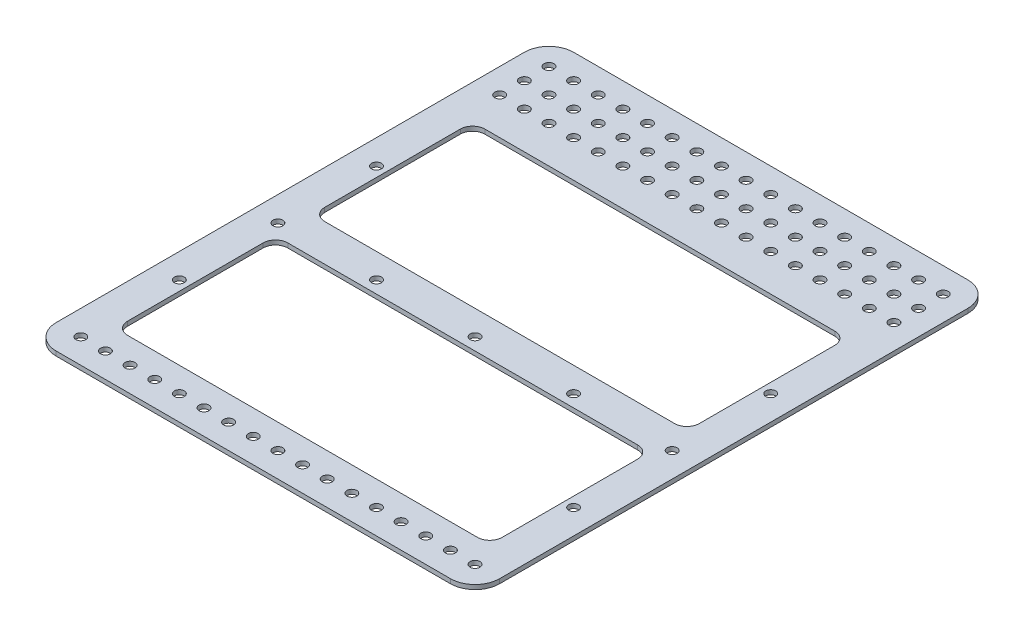
from build123d import *

# Parameters (mm, degrees)
SKETCH3_W           = 228.6
SKETCH3_H           = 266.7
SKETCH3_R           = 2.54
SKETCH3_W_2         = 193.04
SKETCH3_H_2         = 82.55
BOSS_EXTRUDE3_DEPTH = 2.286
FILLET5_R           = 12.7
FILLET6_R           = 6.35


with BuildPart() as part:
    # Sketch3 → Boss-Extrude3 (new body)
    with BuildSketch(Plane(origin=(0, 0, 0), x_dir=(1, 0, 0), z_dir=(0, 1, 0))):
        with Locations((114.3, 133.35)):
            Rectangle(SKETCH3_W, SKETCH3_H)
        with Locations(Location((12.7, 254, 0), (0, 0, 270))):
            Circle(SKETCH3_R, mode=Mode.SUBTRACT)
        with Locations(Location((25.4, 254, 0), (0, 0, 270))):
            Circle(SKETCH3_R, mode=Mode.SUBTRACT)
        with Locations(Location((38.1, 254, 0), (0, 0, 270))):
            Circle(SKETCH3_R, mode=Mode.SUBTRACT)
        with Locations(Location((50.8, 254, 0), (0, 0, 270))):
            Circle(SKETCH3_R, mode=Mode.SUBTRACT)
        with Locations(Location((63.5, 254, 0), (0, 0, 270))):
            Circle(SKETCH3_R, mode=Mode.SUBTRACT)
        with Locations(Location((76.2, 254, 0), (0, 0, 270))):
            Circle(SKETCH3_R, mode=Mode.SUBTRACT)
        with Locations(Location((88.9, 254, 0), (0, 0, 270))):
            Circle(SKETCH3_R, mode=Mode.SUBTRACT)
        with Locations(Location((101.6, 254, 0), (0, 0, 270))):
            Circle(SKETCH3_R, mode=Mode.SUBTRACT)
        with Locations(Location((114.3, 254, 0), (0, 0, 270))):
            Circle(SKETCH3_R, mode=Mode.SUBTRACT)
        with Locations(Location((127, 254, 0), (0, 0, 270))):
            Circle(SKETCH3_R, mode=Mode.SUBTRACT)
        with Locations(Location((139.7, 254, 0), (0, 0, 270))):
            Circle(SKETCH3_R, mode=Mode.SUBTRACT)
        with Locations(Location((152.4, 254, 0), (0, 0, 270))):
            Circle(SKETCH3_R, mode=Mode.SUBTRACT)
        with Locations(Location((165.1, 254, 0), (0, 0, 270))):
            Circle(SKETCH3_R, mode=Mode.SUBTRACT)
        with Locations(Location((177.8, 254, 0), (0, 0, 270))):
            Circle(SKETCH3_R, mode=Mode.SUBTRACT)
        with Locations(Location((190.5, 254, 0), (0, 0, 270))):
            Circle(SKETCH3_R, mode=Mode.SUBTRACT)
        with Locations(Location((203.2, 254, 0), (0, 0, 270))):
            Circle(SKETCH3_R, mode=Mode.SUBTRACT)
        with Locations(Location((215.9, 254, 0), (0, 0, 270))):
            Circle(SKETCH3_R, mode=Mode.SUBTRACT)
        with Locations(Location((25.4, 241.3, 0), (0, 0, 270))):
            Circle(SKETCH3_R, mode=Mode.SUBTRACT)
        with Locations(Location((38.1, 241.3, 0), (0, 0, 270))):
            Circle(SKETCH3_R, mode=Mode.SUBTRACT)
        with Locations(Location((50.8, 241.3, 0), (0, 0, 270))):
            Circle(SKETCH3_R, mode=Mode.SUBTRACT)
        with Locations(Location((63.5, 241.3, 0), (0, 0, 270))):
            Circle(SKETCH3_R, mode=Mode.SUBTRACT)
        with Locations(Location((76.2, 241.3, 0), (0, 0, 270))):
            Circle(SKETCH3_R, mode=Mode.SUBTRACT)
        with Locations(Location((88.9, 241.3, 0), (0, 0, 270))):
            Circle(SKETCH3_R, mode=Mode.SUBTRACT)
        with Locations(Location((101.6, 241.3, 0), (0, 0, 270))):
            Circle(SKETCH3_R, mode=Mode.SUBTRACT)
        with Locations(Location((114.3, 241.3, 0), (0, 0, 270))):
            Circle(SKETCH3_R, mode=Mode.SUBTRACT)
        with Locations(Location((127, 241.3, 0), (0, 0, 270))):
            Circle(SKETCH3_R, mode=Mode.SUBTRACT)
        with Locations(Location((139.7, 241.3, 0), (0, 0, 270))):
            Circle(SKETCH3_R, mode=Mode.SUBTRACT)
        with Locations(Location((152.4, 241.3, 0), (0, 0, 270))):
            Circle(SKETCH3_R, mode=Mode.SUBTRACT)
        with Locations(Location((165.1, 241.3, 0), (0, 0, 270))):
            Circle(SKETCH3_R, mode=Mode.SUBTRACT)
        with Locations(Location((177.8, 241.3, 0), (0, 0, 270))):
            Circle(SKETCH3_R, mode=Mode.SUBTRACT)
        with Locations(Location((190.5, 241.3, 0), (0, 0, 270))):
            Circle(SKETCH3_R, mode=Mode.SUBTRACT)
        with Locations(Location((203.2, 241.3, 0), (0, 0, 270))):
            Circle(SKETCH3_R, mode=Mode.SUBTRACT)
        with Locations(Location((215.9, 241.3, 0), (0, 0, 270))):
            Circle(SKETCH3_R, mode=Mode.SUBTRACT)
        with Locations(Location((25.4, 228.6, 0), (0, 0, 270))):
            Circle(SKETCH3_R, mode=Mode.SUBTRACT)
        with Locations(Location((38.1, 228.6, 0), (0, 0, 270))):
            Circle(SKETCH3_R, mode=Mode.SUBTRACT)
        with Locations(Location((50.8, 228.6, 0), (0, 0, 270))):
            Circle(SKETCH3_R, mode=Mode.SUBTRACT)
        with Locations(Location((63.5, 228.6, 0), (0, 0, 270))):
            Circle(SKETCH3_R, mode=Mode.SUBTRACT)
        with Locations(Location((76.2, 228.6, 0), (0, 0, 270))):
            Circle(SKETCH3_R, mode=Mode.SUBTRACT)
        with Locations(Location((88.9, 228.6, 0), (0, 0, 270))):
            Circle(SKETCH3_R, mode=Mode.SUBTRACT)
        with Locations(Location((101.6, 228.6, 0), (0, 0, 270))):
            Circle(SKETCH3_R, mode=Mode.SUBTRACT)
        with Locations(Location((114.3, 228.6, 0), (0, 0, 270))):
            Circle(SKETCH3_R, mode=Mode.SUBTRACT)
        with Locations(Location((127, 228.6, 0), (0, 0, 270))):
            Circle(SKETCH3_R, mode=Mode.SUBTRACT)
        with Locations(Location((139.7, 228.6, 0), (0, 0, 270))):
            Circle(SKETCH3_R, mode=Mode.SUBTRACT)
        with Locations(Location((152.4, 228.6, 0), (0, 0, 270))):
            Circle(SKETCH3_R, mode=Mode.SUBTRACT)
        with Locations(Location((165.1, 228.6, 0), (0, 0, 270))):
            Circle(SKETCH3_R, mode=Mode.SUBTRACT)
        with Locations(Location((177.8, 228.6, 0), (0, 0, 270))):
            Circle(SKETCH3_R, mode=Mode.SUBTRACT)
        with Locations(Location((190.5, 228.6, 0), (0, 0, 270))):
            Circle(SKETCH3_R, mode=Mode.SUBTRACT)
        with Locations(Location((203.2, 228.6, 0), (0, 0, 270))):
            Circle(SKETCH3_R, mode=Mode.SUBTRACT)
        with Locations(Location((215.9, 228.6, 0), (0, 0, 270))):
            Circle(SKETCH3_R, mode=Mode.SUBTRACT)
        with Locations(Location((12.7, 241.3, 0), (0, 0, 270))):
            Circle(SKETCH3_R, mode=Mode.SUBTRACT)
        with Locations(Location((12.7, 228.6, 0), (0, 0, 270))):
            Circle(SKETCH3_R, mode=Mode.SUBTRACT)
        with Locations(Location((12.7, 12.7, 0), (0, 0, 270))):
            Circle(SKETCH3_R, mode=Mode.SUBTRACT)
        with Locations(Location((25.4, 12.7, 0), (0, 0, 270))):
            Circle(SKETCH3_R, mode=Mode.SUBTRACT)
        with Locations(Location((38.1, 12.7, 0), (0, 0, 270))):
            Circle(SKETCH3_R, mode=Mode.SUBTRACT)
        with Locations(Location((50.8, 12.7, 0), (0, 0, 270))):
            Circle(SKETCH3_R, mode=Mode.SUBTRACT)
        with Locations(Location((63.5, 12.7, 0), (0, 0, 270))):
            Circle(SKETCH3_R, mode=Mode.SUBTRACT)
        with Locations(Location((76.2, 12.7, 0), (0, 0, 270))):
            Circle(SKETCH3_R, mode=Mode.SUBTRACT)
        with Locations(Location((88.9, 12.7, 0), (0, 0, 270))):
            Circle(SKETCH3_R, mode=Mode.SUBTRACT)
        with Locations(Location((101.6, 12.7, 0), (0, 0, 270))):
            Circle(SKETCH3_R, mode=Mode.SUBTRACT)
        with Locations(Location((114.3, 12.7, 0), (0, 0, 270))):
            Circle(SKETCH3_R, mode=Mode.SUBTRACT)
        with Locations(Location((127, 12.7, 0), (0, 0, 270))):
            Circle(SKETCH3_R, mode=Mode.SUBTRACT)
        with Locations(Location((139.7, 12.7, 0), (0, 0, 270))):
            Circle(SKETCH3_R, mode=Mode.SUBTRACT)
        with Locations(Location((152.4, 12.7, 0), (0, 0, 270))):
            Circle(SKETCH3_R, mode=Mode.SUBTRACT)
        with Locations(Location((165.1, 12.7, 0), (0, 0, 270))):
            Circle(SKETCH3_R, mode=Mode.SUBTRACT)
        with Locations(Location((177.8, 12.7, 0), (0, 0, 270))):
            Circle(SKETCH3_R, mode=Mode.SUBTRACT)
        with Locations(Location((190.5, 12.7, 0), (0, 0, 270))):
            Circle(SKETCH3_R, mode=Mode.SUBTRACT)
        with Locations(Location((203.2, 12.7, 0), (0, 0, 270))):
            Circle(SKETCH3_R, mode=Mode.SUBTRACT)
        with Locations(Location((215.9, 12.7, 0), (0, 0, 270))):
            Circle(SKETCH3_R, mode=Mode.SUBTRACT)
        with Locations(Location((12.7, 114.3, 0), (0, 0, 270))):
            Circle(SKETCH3_R, mode=Mode.SUBTRACT)
        with Locations(Location((63.5, 114.3, 0), (0, 0, 270))):
            Circle(SKETCH3_R, mode=Mode.SUBTRACT)
        with Locations(Location((114.3, 114.3, 0), (0, 0, 270))):
            Circle(SKETCH3_R, mode=Mode.SUBTRACT)
        with Locations(Location((165.1, 114.3, 0), (0, 0, 270))):
            Circle(SKETCH3_R, mode=Mode.SUBTRACT)
        with Locations(Location((215.9, 114.3, 0), (0, 0, 270))):
            Circle(SKETCH3_R, mode=Mode.SUBTRACT)
        with Locations(Location((12.7, 165.1, 0), (0, 0, 270))):
            Circle(SKETCH3_R, mode=Mode.SUBTRACT)
        with Locations(Location((215.9, 165.1, 0), (0, 0, 270))):
            Circle(SKETCH3_R, mode=Mode.SUBTRACT)
        with Locations(Location((12.7, 63.5, 0), (0, 0, 270))):
            Circle(SKETCH3_R, mode=Mode.SUBTRACT)
        with Locations(Location((215.9, 63.5, 0), (0, 0, 270))):
            Circle(SKETCH3_R, mode=Mode.SUBTRACT)
        with Locations((114.3, 66.675)):
            Rectangle(SKETCH3_W_2, SKETCH3_H_2, mode=Mode.SUBTRACT)
        with Locations((114.3, 168.275)):
            Rectangle(SKETCH3_W_2, SKETCH3_H_2, mode=Mode.SUBTRACT)
    extrude(amount=BOSS_EXTRUDE3_DEPTH)

    # Fillet5
    fillet5_edges = [part.edges().sort_by_distance(p)[0] for p in [
        (0, 1.143, -266.7),
        (228.6, 1.143, -266.7),
        (228.6, 1.143, 0),
        (0, 1.143, 0),
    ]]
    fillet(fillet5_edges, radius=FILLET5_R)

    # Fillet6
    fillet6_edges = [part.edges().sort_by_distance(p)[0] for p in [
        (210.82, 1.143, -107.95),
        (17.78, 1.143, -107.95),
        (17.78, 1.143, -25.4),
        (210.82, 1.143, -25.4),
        (17.78, 1.143, -209.55),
        (17.78, 1.143, -127),
        (210.82, 1.143, -127),
        (210.82, 1.143, -209.55),
    ]]
    fillet(fillet6_edges, radius=FILLET6_R)


solid = part.part
